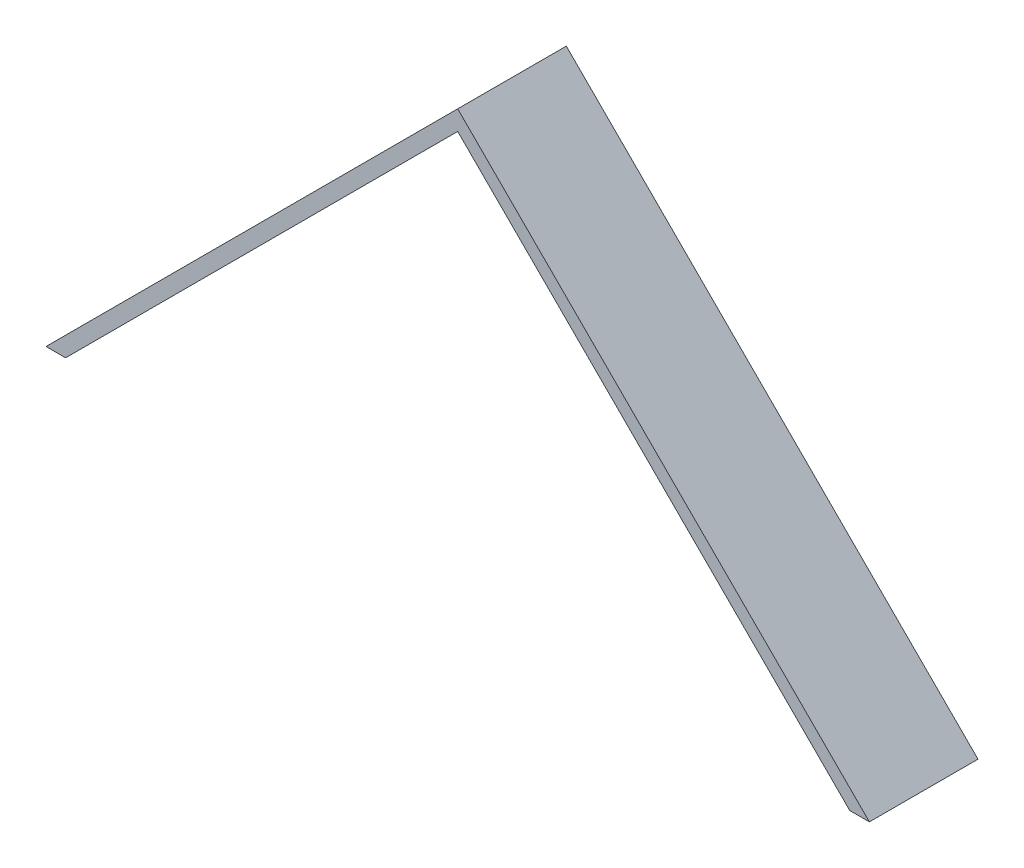
from build123d import *

# Parameters (mm, degrees)
BOSS_EXTRUDE1_DEPTH = 149.225


with BuildPart() as part:
    # Sketch1 → Boss-Extrude1 (new body)
    with BuildSketch(Plane.XY):
        Polygon((0, 565.685424949), (-565.685424949, 0), (-538.744656586, 0), (0, 538.744656586), (538.744656586, 0), (565.685424949, 0), align=None)
    extrude(amount=BOSS_EXTRUDE1_DEPTH)


solid = part.part
